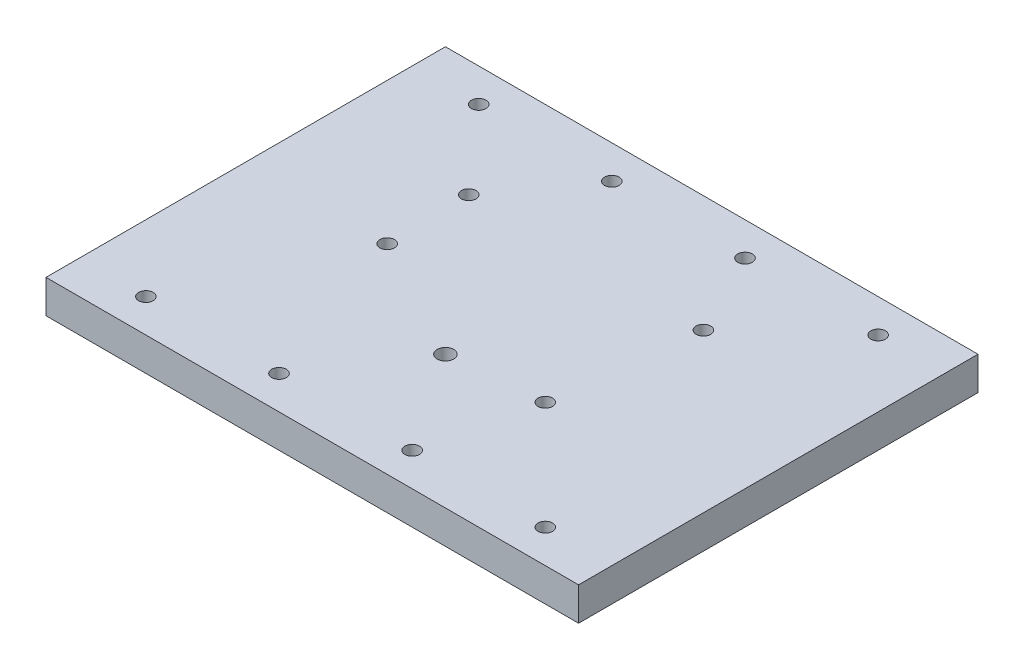
from build123d import *

# Parameters (mm, degrees)
SKETCH1_W           = 203.2
SKETCH1_H           = 152.4
BOSS_EXTRUDE1_DEPTH = 12.7
SKETCH2_R           = 2.778125
CUT_EXTRUDE1_DEPTH  = 255.31730181
LPATTERN1_COUNT     = 4
LPATTERN1_PITCH     = 50.8
SKETCH4_R           = 2.778125
SKETCH4_R_2         = 3.175
CUT_EXTRUDE2_DEPTH  = 255.31730181


with BuildPart() as part:
    # Sketch1 → Boss-Extrude1 (new body)
    with BuildSketch(Plane(origin=(0, 0, 0), x_dir=(1, 0, 0), z_dir=(0, 1, 0))):
        with Locations((101.6, 76.2)):
            Rectangle(SKETCH1_W, SKETCH1_H)
    extrude(amount=BOSS_EXTRUDE1_DEPTH)

    # Sketch2 → Cut-Extrude1 (cut, through all)
    with BuildSketch(Plane(origin=(0, 12.7, 0), x_dir=(1, 0, 0), z_dir=(0, 1, 0))):
        with Locations(Location((25.4, 139.7, 0), (0, 0, 270))):
            Circle(SKETCH2_R)
        with Locations(Location((25.4, 12.7, 0), (0, 0, 270))):
            Circle(SKETCH2_R)
    cut_extrude1 = extrude(amount=-CUT_EXTRUDE1_DEPTH, mode=Mode.SUBTRACT)

    # LPattern1: Cut-Extrude1 ×4
    with Locations(*[(i * LPATTERN1_PITCH, 0, 0) for i in range(1, LPATTERN1_COUNT)]):
        add(cut_extrude1, mode=Mode.SUBTRACT)

    # Sketch4 → Cut-Extrude2 (cut, through all)
    with BuildSketch(Plane(origin=(0, 12.7, 0), x_dir=(1, 0, 0), z_dir=(0, 1, 0))):
        with Locations(Location((53.975, 76.2, 0), (0, 0, 270))):
            Circle(SKETCH4_R)
        with Locations(Location((53.34, 107.95, 0), (0, 0, 270))):
            Circle(SKETCH4_R)
        with Locations(Location((101.6, 50.8, 0), (0, 0, 270))):
            Circle(SKETCH4_R_2)
        with Locations(Location((142.875, 107.95, 0), (0, 0, 270))):
            Circle(SKETCH4_R)
        with Locations(Location((136.525, 53.975, 0), (0, 0, 270))):
            Circle(SKETCH4_R)
    extrude(amount=-CUT_EXTRUDE2_DEPTH, mode=Mode.SUBTRACT)


solid = part.part
